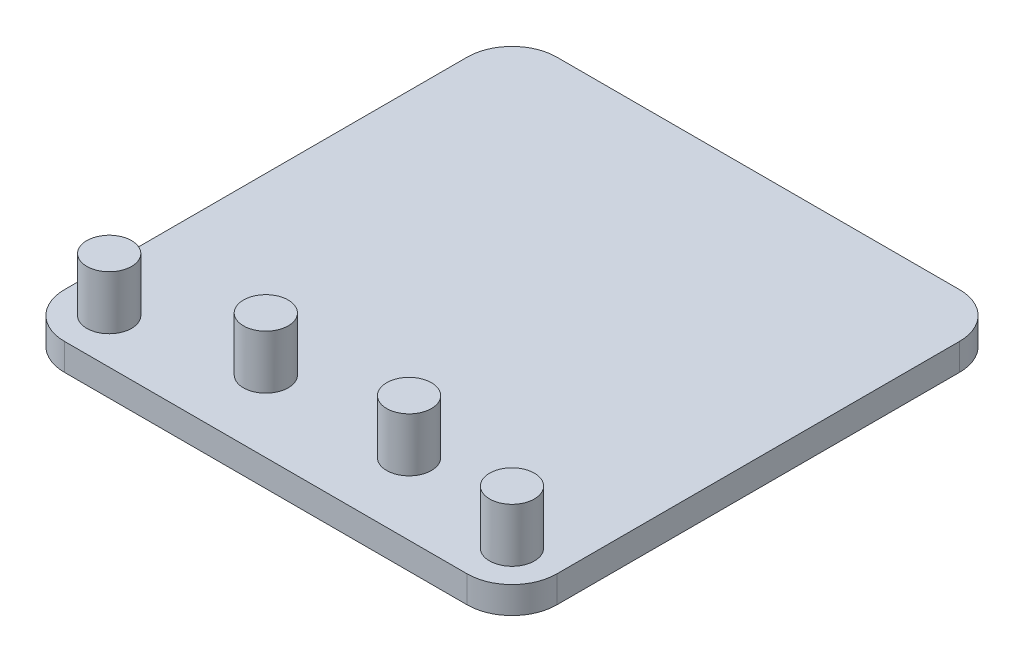
from build123d import *

# Parameters (mm, degrees)
SKETCH1_W           = 110
SKETCH1_H           = 110
BOSS_EXTRUDE1_DEPTH = 6
FILLET1_R           = 10
SKETCH12_R          = 5
BOSS_EXTRUDE5_DEPTH = 12
SKETCH13_R          = 5
BOSS_EXTRUDE6_DEPTH = 12
SKETCH14_R          = 5
BOSS_EXTRUDE7_DEPTH = 12
SKETCH15_R          = 5
BOSS_EXTRUDE8_DEPTH = 12


with BuildPart() as part:
    # Sketch1 → Boss-Extrude1 (new body)
    with BuildSketch(Plane(origin=(0, 0, 0), x_dir=(1, 0, 0), z_dir=(0, 1, 0))):
        with Locations((55, 55)):
            Rectangle(SKETCH1_W, SKETCH1_H)
    extrude(amount=BOSS_EXTRUDE1_DEPTH)

    # Fillet1
    fillet1_edges = [part.edges().sort_by_distance(p)[0] for p in [
        (0, 3, -110),
        (110, 3, -110),
        (110, 3, 0),
        (0, 3, 0),
    ]]
    fillet(fillet1_edges, radius=FILLET1_R)

    # Sketch12 → Boss-Extrude5 (add)
    with BuildSketch(Plane(origin=(0, 6, 0), x_dir=(1, 0, 0), z_dir=(0, 1, 0))):
        with Locations(Location((39, 16, 0), (0, 0, 90))):
            Circle(SKETCH12_R)
    extrude(amount=BOSS_EXTRUDE5_DEPTH)

    # Sketch13 → Boss-Extrude6 (add)
    with BuildSketch(Plane(origin=(0, 6, 0), x_dir=(1, 0, 0), z_dir=(0, 1, 0))):
        with Locations(Location((71, 16, 0), (0, 0, 90))):
            Circle(SKETCH13_R)
    extrude(amount=BOSS_EXTRUDE6_DEPTH)

    # Sketch14 → Boss-Extrude7 (add)
    with BuildSketch(Plane(origin=(0, 6, 0), x_dir=(1, 0, 0), z_dir=(0, 1, 0))):
        with Locations(Location((10, 10, 0), (0, 0, 90))):
            Circle(SKETCH14_R)
    extrude(amount=BOSS_EXTRUDE7_DEPTH)

    # Sketch15 → Boss-Extrude8 (add)
    with BuildSketch(Plane(origin=(0, 6, 0), x_dir=(1, 0, 0), z_dir=(0, 1, 0))):
        with Locations(Location((100, 10, 0), (0, 0, 90))):
            Circle(SKETCH15_R)
    extrude(amount=BOSS_EXTRUDE8_DEPTH)


solid = part.part
